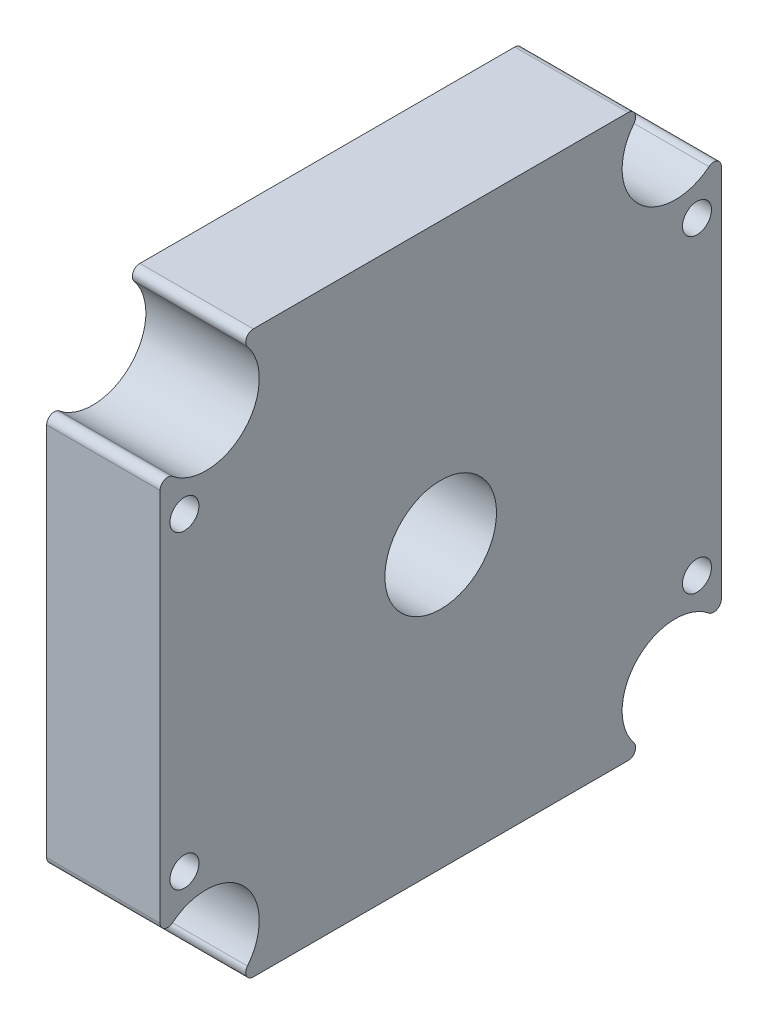
from build123d import *

# Parameters (mm, degrees)
SKETCH1_W               = 56.1848
SKETCH1_H               = 56.1848
BOSS_EXTRUDE1_DEPTH     = 11.3538
SKETCH2_R               = 2.54
CUT_EXTRUDE1_DEPTH      = 42.31918017
FILLET1_R               = 3.175
SKETCH7_R               = 5.334
CUT_EXTRUDE5_DEPTH      = 42.31918017
FILLET4_R               = 0.762
M3_5X0_6_TAPPED_HOLE1_D = 2.9
SKETCH11_R              = 5.588
CUT_EXTRUDE6_DEPTH      = 42.31918017


with BuildPart() as part:
    # Sketch1 → Boss-Extrude1 (new body)
    with BuildSketch(Plane(origin=(0, 0, 0), x_dir=(0, 0, -1), z_dir=(1, 0, 0))):
        Rectangle(SKETCH1_W, SKETCH1_H)
    extrude(amount=BOSS_EXTRUDE1_DEPTH)

    # Sketch2 → Cut-Extrude1 (cut, through all)
    with BuildSketch(Plane(origin=(11.3538, 0, 0), x_dir=(0, 0, -1), z_dir=(1, 0, 0))):
        with Locations((-23.495, 23.495)):
            Circle(SKETCH2_R)
        with Locations(Location((23.495, 23.495, 0), (0, 0, 180))):
            Circle(SKETCH2_R)
        with Locations((23.495, -23.495)):
            Circle(SKETCH2_R)
        with Locations(Location((-23.495, -23.495, 0), (0, 0, 180))):
            Circle(SKETCH2_R)
    extrude(amount=-CUT_EXTRUDE1_DEPTH, mode=Mode.SUBTRACT)

    # Fillet1
    fillet1_edges = [part.edges().sort_by_distance(p)[0] for p in [
        (5.6769, -28.0924, -28.0924),
        (5.6769, -28.0924, 28.0924),
        (5.6769, 28.0924, 28.0924),
        (5.6769, 28.0924, -28.0924),
    ]]
    fillet(fillet1_edges, radius=FILLET1_R)

    # Sketch7 → Cut-Extrude5 (cut, through all)
    with BuildSketch(Plane.ZY):
        with Locations((-23.495, 23.495)):
            Circle(SKETCH7_R)
        with Locations((23.495, 23.495)):
            Circle(SKETCH7_R)
        with Locations((23.495, -23.495)):
            Circle(SKETCH7_R)
        with Locations((-23.495, -23.495)):
            Circle(SKETCH7_R)
    extrude(amount=-CUT_EXTRUDE5_DEPTH, mode=Mode.SUBTRACT)

    # Fillet4
    fillet4_edges = [part.edges().sort_by_distance(p)[0] for p in [
        (5.6769, 20.790287586, -28.0924),
        (5.6769, 28.0924, -20.790287586),
        (5.6769, 28.0924, 20.790287586),
        (5.6769, 20.790287586, 28.0924),
        (5.6769, -20.790287586, 28.0924),
        (5.6769, -28.0924, 20.790287586),
        (5.6769, -20.790287586, -28.0924),
        (5.6769, -28.0924, -20.790287586),
    ]]
    fillet(fillet4_edges, radius=FILLET4_R)

    # M3.5x0.6 Tapped Hole1 (through all)
    with Locations(Plane(origin=(11.3538, 0, 0), x_dir=(0, 0, -1), z_dir=(1, 0, 0))):
        with Locations((-25.654, 15.494), (25.654, 15.494), (25.654, -15.494), (-25.654, -15.494)):
            Hole(M3_5X0_6_TAPPED_HOLE1_D / 2)

    # Sketch11 → Cut-Extrude6 (cut, through all)
    with BuildSketch(Plane(origin=(11.3538, 0, 0), x_dir=(0, 0, -1), z_dir=(1, 0, 0))):
        Circle(SKETCH11_R)
    extrude(amount=-CUT_EXTRUDE6_DEPTH, mode=Mode.SUBTRACT)


solid = part.part
